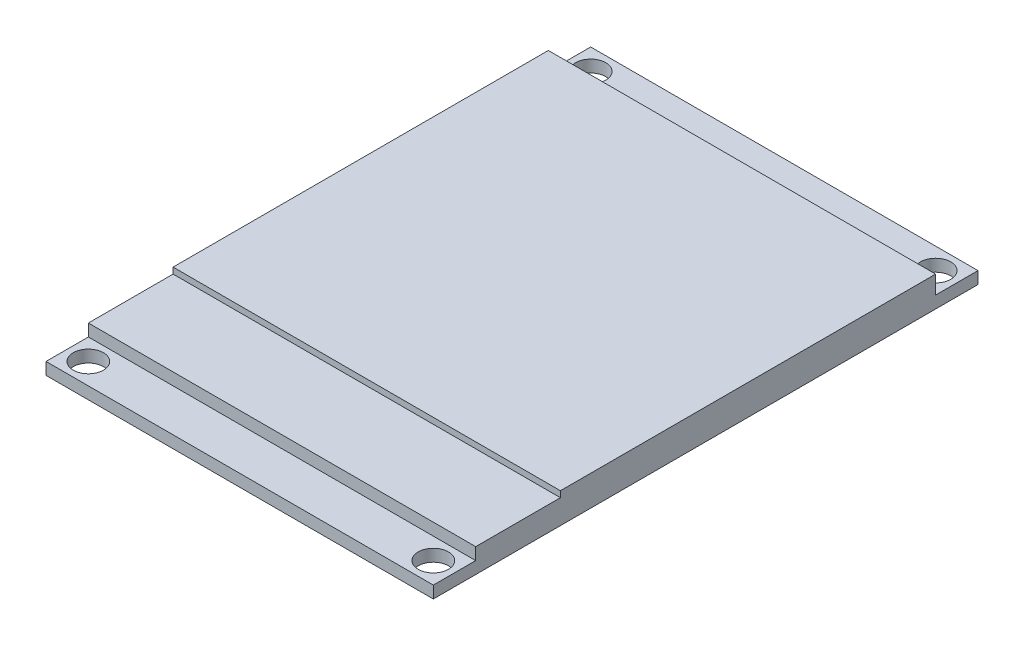
from build123d import *

# Parameters (mm, degrees)
SKETCH_1_W      = 32
SKETCH_1_H      = 45
SKETCH_1_R      = 1.25
EXTRUDE_1_DEPTH = 1
SKETCH_2_W      = 32
SKETCH_2_H      = 31
EXTRUDE_2_DEPTH = 1.5
SKETCH_3_W      = 32
SKETCH_3_H      = 7
EXTRUDE_3_DEPTH = 1


with BuildPart() as part:
    # 草图1 → 凸台-拉伸1 (new body)
    with BuildSketch(Plane(origin=(0, 0, 0), x_dir=(1, 0, 0), z_dir=(0, 1, 0))):
        with Locations((16, 22.5)):
            Rectangle(SKETCH_1_W, SKETCH_1_H)
        with Locations(Location((30.25, 43.25, 0), (0, 0, 270))):
            Circle(SKETCH_1_R, mode=Mode.SUBTRACT)
        with Locations(Location((30.25, 1.75, 0), (0, 0, 90))):
            Circle(SKETCH_1_R, mode=Mode.SUBTRACT)
        with Locations(Location((1.75, 1.75, 0), (0, 0, 270))):
            Circle(SKETCH_1_R, mode=Mode.SUBTRACT)
        with Locations(Location((1.75, 43.25, 0), (0, 0, 90))):
            Circle(SKETCH_1_R, mode=Mode.SUBTRACT)
    extrude(amount=EXTRUDE_1_DEPTH)

    # 草图2 → 凸台-拉伸2 (add)
    with BuildSketch(Plane(origin=(0, 1, 0), x_dir=(1, 0, 0), z_dir=(0, 1, 0))):
        with Locations((16, 26)):
            Rectangle(SKETCH_2_W, SKETCH_2_H)
    extrude(amount=EXTRUDE_2_DEPTH)

    # 草图3 → 凸台-拉伸3 (add)
    with BuildSketch(Plane(origin=(0, 1, 0), x_dir=(1, 0, 0), z_dir=(0, 1, 0))):
        with Locations((16, 7)):
            Rectangle(SKETCH_3_W, SKETCH_3_H)
    extrude(amount=EXTRUDE_3_DEPTH)


solid = part.part
